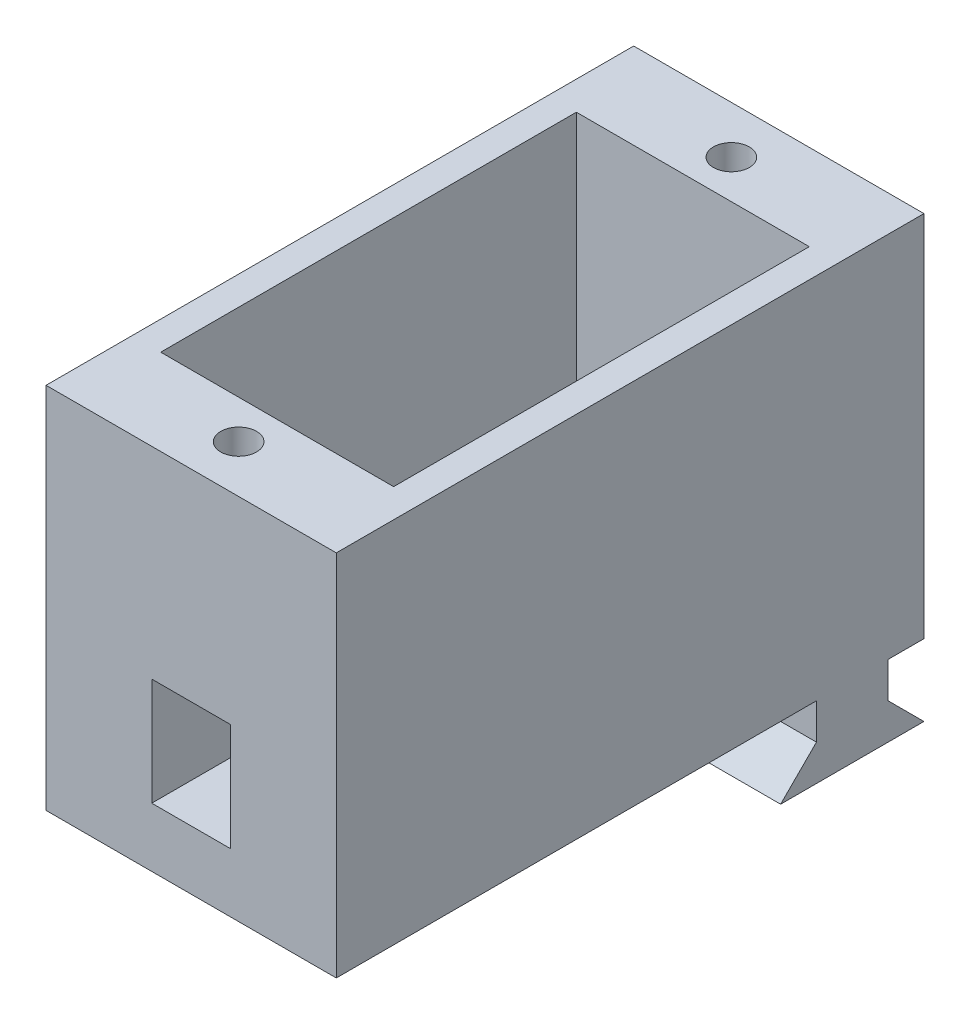
from build123d import *

# Parameters (mm, degrees)
BOSS_EXTRUDE1_START = 56.075
SKETCH1_W           = 16.2
SKETCH1_H           = 32.8
BOSS_EXTRUDE1_DEPTH = 10.275
BOSS_EXTRUDE2_START = -85
BOSS_EXTRUDE2_DEPTH = 8.1
CUT_EXTRUDE1_START  = 57.725
SKETCH3_W           = 13
SKETCH3_H           = 23.2
CUT_EXTRUDE1_DEPTH  = 8.625
CUT_EXTRUDE2_START  = 63.35
SKETCH4_R           = 1
CUT_EXTRUDE2_DEPTH  = 3
CUT_EXTRUDE3_START  = 63.35
SKETCH5_R           = 1
CUT_EXTRUDE3_DEPTH  = 3
CUT_EXTRUDE4_START  = 47.1
SKETCH6_R           = 3.15
CUT_EXTRUDE4_DEPTH  = 1.3
CUT_EXTRUDE5_START  = 8.5
SKETCH7_W           = 4.4
SKETCH7_H           = 6
CUT_EXTRUDE5_DEPTH  = 2.4


with BuildPart() as part:
    # Sketch1 → Boss-Extrude1 (new, symmetric)
    with BuildSketch(Plane(origin=(0, 0, 0), x_dir=(1, 0, 0), z_dir=(0, 1, 0)).offset(BOSS_EXTRUDE1_START)):
        with Locations((-85, 5.5)):
            Rectangle(SKETCH1_W, SKETCH1_H)
    extrude(amount=BOSS_EXTRUDE1_DEPTH, both=True)

    # Sketch2 → Boss-Extrude2 (add, symmetric)
    with BuildSketch(Plane(origin=(0, 0, 0), x_dir=(0, 0, -1), z_dir=(1, 0, 0)).offset(BOSS_EXTRUDE2_START)):
        Polygon((19.9, 46.3), (15.9, 46.3), (15.9, 43.8), (13.9, 41.8), (21.9, 41.8), (19.9, 43.8), align=None)
    extrude(amount=BOSS_EXTRUDE2_DEPTH, both=True)

    # Sketch3 → Cut-Extrude1 (cut, symmetric)
    with BuildSketch(Plane(origin=(0, 0, 0), x_dir=(1, 0, 0), z_dir=(0, 1, 0)).offset(CUT_EXTRUDE1_START)):
        with Locations((-85, 5.5)):
            Rectangle(SKETCH3_W, SKETCH3_H)
    extrude(amount=CUT_EXTRUDE1_DEPTH, both=True, mode=Mode.SUBTRACT)

    # Sketch4 → Cut-Extrude2 (cut, symmetric)
    with BuildSketch(Plane(origin=(0, 0, 0), x_dir=(1, 0, 0), z_dir=(0, 1, 0)).offset(CUT_EXTRUDE2_START)):
        with Locations(Location((-85, 19.25, 0), (0, 0, 270))):
            Circle(SKETCH4_R)
    extrude(amount=CUT_EXTRUDE2_DEPTH, both=True, mode=Mode.SUBTRACT)

    # Sketch5 → Cut-Extrude3 (cut, symmetric)
    with BuildSketch(Plane(origin=(0, 0, 0), x_dir=(1, 0, 0), z_dir=(0, 1, 0)).offset(CUT_EXTRUDE3_START)):
        with Locations(Location((-85, -8.25, 0), (0, 0, 270))):
            Circle(SKETCH5_R)
    extrude(amount=CUT_EXTRUDE3_DEPTH, both=True, mode=Mode.SUBTRACT)

    # Sketch6 → Cut-Extrude4 (cut, symmetric)
    with BuildSketch(Plane(origin=(0, 0, 0), x_dir=(1, 0, 0), z_dir=(0, 1, 0)).offset(CUT_EXTRUDE4_START)):
        with Locations(Location((-85, 0, 0), (0, 0, 270))):
            Circle(SKETCH6_R)
    extrude(amount=CUT_EXTRUDE4_DEPTH, both=True, mode=Mode.SUBTRACT)

    # Sketch7 → Cut-Extrude5 (cut, symmetric)
    with BuildSketch(Plane.XY.offset(CUT_EXTRUDE5_START)):
        with Locations((-85, 52.1)):
            Rectangle(SKETCH7_W, SKETCH7_H)
    extrude(amount=CUT_EXTRUDE5_DEPTH, both=True, mode=Mode.SUBTRACT)


solid = part.part
